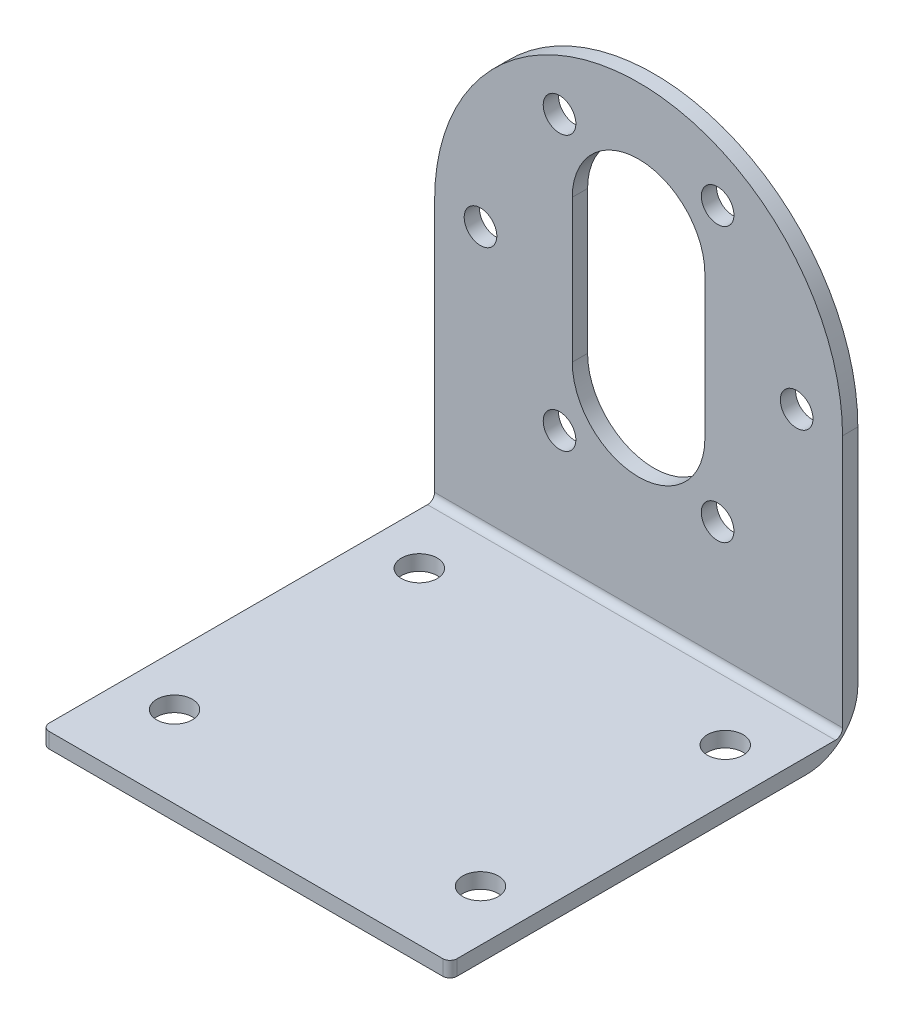
from build123d import *

# Parameters (mm, degrees)
MAINPIECE_DEPTH       = 40
CHASSISHOLES_REACH    = 75.546
SKETCH2_R             = 1.75
DOME_REACH            = 75.546
WHEELMOTORGUIDE_REACH = 75.546
SKETCH4_R             = 1.6
FILLET1_R             = 0.7


with BuildPart() as part:
    # Sketch1 → MainPiece (new body)
    with BuildSketch(Plane(origin=(0, 0, 0), x_dir=(0, 0, -1), z_dir=(1, 0, 0))):
        with BuildLine():
            Line((0, 1.5), (0, 0))
            Line((0, 0), (34.963274192, 0))
            ThreePointArc((34.963274192, 0), (38.524777166, 1.475222834), (40, 5.036725808))
            Line((40, 5.036725808), (40, 47))
            Line((40, 47), (38.5, 47))
            Line((38.5, 47), (38.5, 1.5))
            Line((38.5, 1.5), (0, 1.5))
        make_face()
    extrude(amount=MAINPIECE_DEPTH)

    # Sketch2 → ChassisHoles (cut, up to next)
    with BuildSketch(Plane(origin=(0, 0, 0), x_dir=(-1, 0, 0), z_dir=(0, -1, 0)), mode=Mode.PRIVATE) as chassisholes_sk1:
        with Locations(Location((-5, 8, 0), (0, 0, 90))):
            Circle(SKETCH2_R)
    chassisholes_tool1 = extrude(chassisholes_sk1.sketch, amount=-CHASSISHOLES_REACH, mode=Mode.PRIVATE) & part.part
    # Sketch2 → ChassisHoles (cut, up to next)
    with BuildSketch(Plane(origin=(0, 0, 0), x_dir=(-1, 0, 0), z_dir=(0, -1, 0)), mode=Mode.PRIVATE) as chassisholes_sk2:
        with Locations(Location((-35, 8, 0), (0, 0, 90))):
            Circle(SKETCH2_R)
    chassisholes_tool2 = extrude(chassisholes_sk2.sketch, amount=-CHASSISHOLES_REACH, mode=Mode.PRIVATE) & part.part
    # Sketch2 → ChassisHoles (cut, up to next)
    with BuildSketch(Plane(origin=(0, 0, 0), x_dir=(-1, 0, 0), z_dir=(0, -1, 0)), mode=Mode.PRIVATE) as chassisholes_sk3:
        with Locations(Location((-35, 32, 0), (0, 0, 90))):
            Circle(SKETCH2_R)
    chassisholes_tool3 = extrude(chassisholes_sk3.sketch, amount=-CHASSISHOLES_REACH, mode=Mode.PRIVATE) & part.part
    # Sketch2 → ChassisHoles (cut, up to next)
    with BuildSketch(Plane(origin=(0, 0, 0), x_dir=(-1, 0, 0), z_dir=(0, -1, 0)), mode=Mode.PRIVATE) as chassisholes_sk4:
        with Locations(Location((-5, 32, 0), (0, 0, 90))):
            Circle(SKETCH2_R)
    chassisholes_tool4 = extrude(chassisholes_sk4.sketch, amount=-CHASSISHOLES_REACH, mode=Mode.PRIVATE) & part.part
    add(chassisholes_tool1.solids().sort_by_distance((5, 0, -8))[0], mode=Mode.SUBTRACT)
    add(chassisholes_tool2.solids().sort_by_distance((35, 0, -8))[0], mode=Mode.SUBTRACT)
    add(chassisholes_tool3.solids().sort_by_distance((35, 0, -32))[0], mode=Mode.SUBTRACT)
    add(chassisholes_tool4.solids().sort_by_distance((5, 0, -32))[0], mode=Mode.SUBTRACT)

    # Sketch3 → Dome (cut, up to next)
    with BuildSketch(Plane(origin=(0, 0, -40), x_dir=(-1, 0, 0), z_dir=(0, 0, -1)), mode=Mode.PRIVATE) as dome_sk1:
        with BuildLine():
            Line((-40, 47), (-40, 27))
            ThreePointArc((-40, 27), (-34.142135624, 41.142135624), (-20, 47))
            Line((-20, 47), (-40, 47))
        make_face()
    dome_tool1 = extrude(dome_sk1.sketch, amount=-DOME_REACH, mode=Mode.PRIVATE) & part.part
    # Sketch3 → Dome (cut, up to next)
    with BuildSketch(Plane(origin=(0, 0, -40), x_dir=(-1, 0, 0), z_dir=(0, 0, -1)), mode=Mode.PRIVATE) as dome_sk2:
        with BuildLine():
            Line((0, 47), (-20, 47))
            ThreePointArc((-20, 47), (-5.857864376, 41.142135624), (0, 27))
            Line((0, 27), (0, 47))
        make_face()
    dome_tool2 = extrude(dome_sk2.sketch, amount=-DOME_REACH, mode=Mode.PRIVATE) & part.part
    add(dome_tool1.solids().sort_by_distance((35.532641, 42.532641, -40))[0], mode=Mode.SUBTRACT)
    add(dome_tool2.solids().sort_by_distance((4.467359, 42.532641, -40))[0], mode=Mode.SUBTRACT)

    # Sketch4 → WheelMotorGuide (cut, up to next)
    with BuildSketch(Plane(origin=(0, 0, -40), x_dir=(-1, 0, 0), z_dir=(0, 0, -1)), mode=Mode.PRIVATE) as wheelmotorguide_sk1:
        with Locations((-35.500160217, 27)):
            Circle(SKETCH4_R)
    wheelmotorguide_tool1 = extrude(wheelmotorguide_sk1.sketch, amount=-WHEELMOTORGUIDE_REACH, mode=Mode.PRIVATE) & part.part
    # Sketch4 → WheelMotorGuide (cut, up to next)
    with BuildSketch(Plane(origin=(0, 0, -40), x_dir=(-1, 0, 0), z_dir=(0, 0, -1)), mode=Mode.PRIVATE) as wheelmotorguide_sk2:
        with Locations((-27.750080108, 40.42353251)):
            Circle(SKETCH4_R)
    wheelmotorguide_tool2 = extrude(wheelmotorguide_sk2.sketch, amount=-WHEELMOTORGUIDE_REACH, mode=Mode.PRIVATE) & part.part
    # Sketch4 → WheelMotorGuide (cut, up to next)
    with BuildSketch(Plane(origin=(0, 0, -40), x_dir=(-1, 0, 0), z_dir=(0, 0, -1)), mode=Mode.PRIVATE) as wheelmotorguide_sk3:
        with Locations((-12.249919892, 40.42353251)):
            Circle(SKETCH4_R)
    wheelmotorguide_tool3 = extrude(wheelmotorguide_sk3.sketch, amount=-WHEELMOTORGUIDE_REACH, mode=Mode.PRIVATE) & part.part
    # Sketch4 → WheelMotorGuide (cut, up to next)
    with BuildSketch(Plane(origin=(0, 0, -40), x_dir=(-1, 0, 0), z_dir=(0, 0, -1)), mode=Mode.PRIVATE) as wheelmotorguide_sk4:
        with Locations((-4.499839783, 27)):
            Circle(SKETCH4_R)
    wheelmotorguide_tool4 = extrude(wheelmotorguide_sk4.sketch, amount=-WHEELMOTORGUIDE_REACH, mode=Mode.PRIVATE) & part.part
    # Sketch4 → WheelMotorGuide (cut, up to next)
    with BuildSketch(Plane(origin=(0, 0, -40), x_dir=(-1, 0, 0), z_dir=(0, 0, -1)), mode=Mode.PRIVATE) as wheelmotorguide_sk5:
        with Locations((-12.249919892, 13.57646749)):
            Circle(SKETCH4_R)
    wheelmotorguide_tool5 = extrude(wheelmotorguide_sk5.sketch, amount=-WHEELMOTORGUIDE_REACH, mode=Mode.PRIVATE) & part.part
    # Sketch4 → WheelMotorGuide (cut, up to next)
    with BuildSketch(Plane(origin=(0, 0, -40), x_dir=(-1, 0, 0), z_dir=(0, 0, -1)), mode=Mode.PRIVATE) as wheelmotorguide_sk6:
        with Locations((-27.750080108, 13.57646749)):
            Circle(SKETCH4_R)
    wheelmotorguide_tool6 = extrude(wheelmotorguide_sk6.sketch, amount=-WHEELMOTORGUIDE_REACH, mode=Mode.PRIVATE) & part.part
    # Sketch4 → WheelMotorGuide (cut, up to next)
    with BuildSketch(Plane(origin=(0, 0, -40), x_dir=(-1, 0, 0), z_dir=(0, 0, -1)), mode=Mode.PRIVATE) as wheelmotorguide_sk7:
        with BuildLine():
            Line((-26.5, 20), (-26.5, 34))
            ThreePointArc((-26.5, 34), (-20, 40.5), (-13.5, 34))
            Line((-13.5, 34), (-13.5, 20))
            ThreePointArc((-13.5, 20), (-20, 13.5), (-26.5, 20))
        make_face()
    wheelmotorguide_tool7 = extrude(wheelmotorguide_sk7.sketch, amount=-WHEELMOTORGUIDE_REACH, mode=Mode.PRIVATE) & part.part
    add(wheelmotorguide_tool1.solids().sort_by_distance((35.50016, 27, -40))[0], mode=Mode.SUBTRACT)
    add(wheelmotorguide_tool2.solids().sort_by_distance((27.75008, 40.423533, -40))[0], mode=Mode.SUBTRACT)
    add(wheelmotorguide_tool3.solids().sort_by_distance((12.24992, 40.423533, -40))[0], mode=Mode.SUBTRACT)
    add(wheelmotorguide_tool4.solids().sort_by_distance((4.49984, 27, -40))[0], mode=Mode.SUBTRACT)
    add(wheelmotorguide_tool5.solids().sort_by_distance((12.24992, 13.576467, -40))[0], mode=Mode.SUBTRACT)
    add(wheelmotorguide_tool6.solids().sort_by_distance((27.75008, 13.576467, -40))[0], mode=Mode.SUBTRACT)
    add(wheelmotorguide_tool7.solids().sort_by_distance((20, 27, -40))[0], mode=Mode.SUBTRACT)

    # Fillet1
    fillet1_edges = [part.edges().sort_by_distance(p)[0] for p in [
        (20, 1.5, -38.5),
        (40, 0.75, 0),
        (0, 0.75, 0),
    ]]
    fillet(fillet1_edges, radius=FILLET1_R)


solid = part.part
